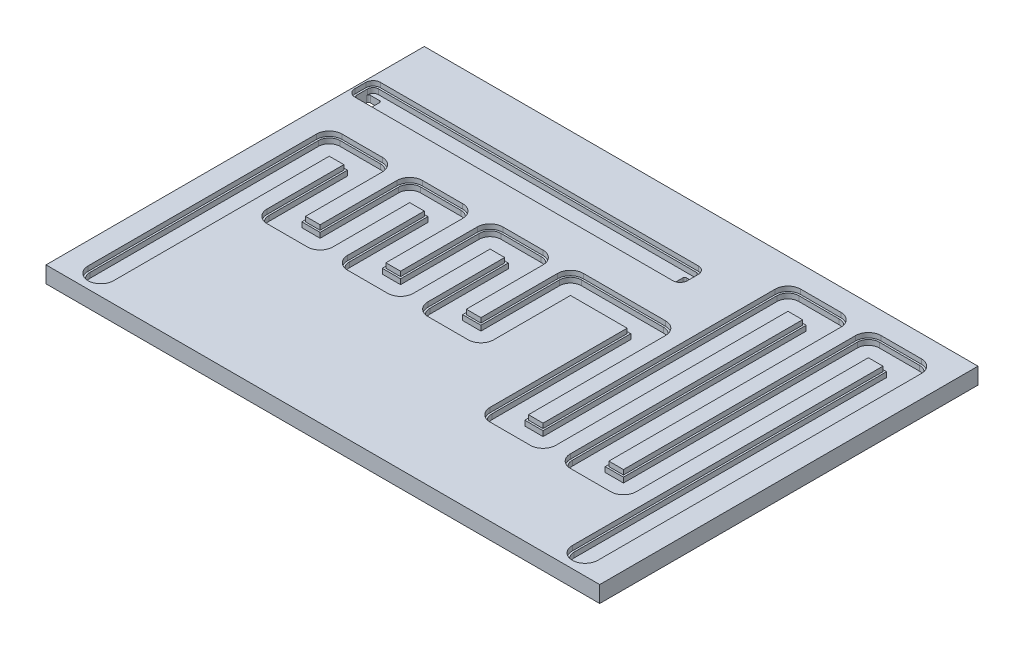
from build123d import *

# Parameters (mm, degrees)
SKETCH_1_W          = 1515
SKETCH_1_H          = 1035
EXTRUDE_1_DEPTH     = 45
CUT_EXTRUDE_1_DEPTH = 13
CUT_EXTRUDE_2_DEPTH = 27
CUT_EXTRUDE_3_DEPTH = 45
CUT_EXTRUDE_5_DEPTH = 13
CUT_EXTRUDE_6_DEPTH = 27
SKETCH_3_R          = 10.25
CUT_EXTRUDE_7_DEPTH = 45


with BuildPart() as part:
    # 草图1 → 凸台-拉伸1 (new body)
    with BuildSketch(Plane(origin=(0, 0, 0), x_dir=(1, 0, 0), z_dir=(0, 1, 0))):
        with Locations((757.5, -517.5)):
            Rectangle(SKETCH_1_W, SKETCH_1_H)
    extrude(amount=-EXTRUDE_1_DEPTH)

    # 草图1<3> → 切除-拉伸1 (cut)
    with BuildSketch(Plane(origin=(0, 0, 0), x_dir=(1, 0, 0), z_dir=(0, 1, 0))):
        with BuildLine():
            Line((5, -195), (5, -165))
            ThreePointArc((5, -165), (10.857864376, -150.857864376), (25, -145))
            Line((25, -145), (895, -145))
            ThreePointArc((895, -145), (909.142135624, -150.857864376), (915, -165))
            Line((915, -165), (915, -195))
            ThreePointArc((915, -195), (909.142135624, -209.142135624), (895, -215))
            Line((895, -215), (25, -215))
            ThreePointArc((25, -215), (10.857864376, -209.142135624), (5, -195))
        make_face()
    extrude(amount=-CUT_EXTRUDE_1_DEPTH, mode=Mode.SUBTRACT)

    # 草图1<5> → 切除-拉伸2 (cut)
    with BuildSketch(Plane(origin=(0, 0, 0), x_dir=(1, 0, 0), z_dir=(0, 1, 0))):
        with BuildLine():
            Line((25, -150), (895, -150))
            ThreePointArc((895, -150), (905.606601718, -154.393398282), (910, -165))
            Line((910, -165), (910, -195))
            ThreePointArc((910, -195), (905.606601718, -205.606601718), (895, -210))
            Line((895, -210), (25, -210))
            ThreePointArc((25, -210), (14.393398282, -205.606601718), (10, -195))
            Line((10, -195), (10, -165))
            ThreePointArc((10, -165), (14.393398282, -154.393398282), (25, -150))
        make_face()
    extrude(amount=-CUT_EXTRUDE_2_DEPTH, mode=Mode.SUBTRACT)

    # 草图1<6> → 切除-拉伸3 (cut)
    with BuildSketch(Plane(origin=(0, 0, 0), x_dir=(1, 0, 0), z_dir=(0, 1, 0))):
        with BuildLine():
            Line((40, -197.5), (15, -197.5))
            ThreePointArc((15, -197.5), (11.464466094, -196.035533906), (10, -192.5))
            Line((10, -192.5), (10, -167.5))
            ThreePointArc((10, -167.5), (11.464466094, -163.964466094), (15, -162.5))
            Line((15, -162.5), (40, -162.5))
            ThreePointArc((40, -162.5), (43.535533906, -163.964466094), (45, -167.5))
            Line((45, -167.5), (45, -192.5))
            ThreePointArc((45, -192.5), (43.535533906, -196.035533906), (40, -197.5))
        make_face()
        with BuildLine():
            Line((905, -197.5), (880, -197.5))
            ThreePointArc((880, -197.5), (876.464466094, -196.035533906), (875, -192.5))
            Line((875, -192.5), (875, -167.5))
            ThreePointArc((875, -167.5), (876.464466094, -163.964466094), (880, -162.5))
            Line((880, -162.5), (905, -162.5))
            ThreePointArc((905, -162.5), (908.535533906, -163.964466094), (910, -167.5))
            Line((910, -167.5), (910, -192.5))
            ThreePointArc((910, -192.5), (908.535533906, -196.035533906), (905, -197.5))
        make_face()
    extrude(amount=-CUT_EXTRUDE_3_DEPTH, mode=Mode.SUBTRACT)

    # 草图1<9> → 切除-拉伸5 (cut)
    with BuildSketch(Plane(origin=(0, 0, 0), x_dir=(1, 0, 0), z_dir=(0, 1, 0))):
        with BuildLine():
            Line((60, -980), (60, -355))
            ThreePointArc((60, -355), (70.251262658, -330.251262658), (95, -320))
            Line((95, -320), (205, -320))
            ThreePointArc((205, -320), (229.748737342, -330.251262658), (240, -355))
            Line((240, -355), (240, -565))
            Line((240, -565), (280, -565))
            Line((280, -565), (280, -355))
            ThreePointArc((280, -355), (290.251262658, -330.251262658), (315, -320))
            Line((315, -320), (425, -320))
            ThreePointArc((425, -320), (449.748737342, -330.251262658), (460, -355))
            Line((460, -355), (460, -565))
            Line((460, -565), (500, -565))
            Line((500, -565), (500, -355))
            ThreePointArc((500, -355), (510.251262658, -330.251262658), (535, -320))
            Line((535, -320), (645, -320))
            ThreePointArc((645, -320), (669.748737342, -330.251262658), (680, -355))
            Line((680, -355), (680, -565))
            Line((680, -565), (720, -565))
            Line((720, -565), (720, -355))
            ThreePointArc((720, -355), (730.251262658, -330.251262658), (755, -320))
            Line((755, -320), (980, -320))
            ThreePointArc((980, -320), (1004.748737342, -330.251262658), (1015, -355))
            Line((1015, -355), (1015, -730))
            Line((1015, -730), (1055, -730))
            Line((1055, -730), (1055, -95))
            ThreePointArc((1055, -95), (1065.251262658, -70.251262658), (1090, -60))
            Line((1090, -60), (1200, -60))
            ThreePointArc((1200, -60), (1224.748737342, -70.251262658), (1235, -95))
            Line((1235, -95), (1235, -730))
            Line((1235, -730), (1275, -730))
            Line((1275, -730), (1275, -95))
            ThreePointArc((1275, -95), (1285.251262658, -70.251262658), (1310, -60))
            Line((1310, -60), (1420, -60))
            ThreePointArc((1420, -60), (1444.748737342, -70.251262658), (1455, -95))
            Line((1455, -95), (1455, -980))
            ThreePointArc((1455, -980), (1420, -1015), (1385, -980))
            Line((1385, -980), (1385, -130))
            Line((1385, -130), (1345, -130))
            Line((1345, -130), (1345, -765))
            ThreePointArc((1345, -765), (1334.748737342, -789.748737342), (1310, -800))
            Line((1310, -800), (1200, -800))
            ThreePointArc((1200, -800), (1175.251262658, -789.748737342), (1165, -765))
            Line((1165, -765), (1165, -130))
            Line((1165, -130), (1125, -130))
            Line((1125, -130), (1125, -765))
            ThreePointArc((1125, -765), (1114.748737342, -789.748737342), (1090, -800))
            Line((1090, -800), (980, -800))
            ThreePointArc((980, -800), (955.251262658, -789.748737342), (945, -765))
            Line((945, -765), (945, -390))
            Line((945, -390), (790, -390))
            Line((790, -390), (790, -600))
            ThreePointArc((790, -600), (779.748737342, -624.748737342), (755, -635))
            Line((755, -635), (645, -635))
            ThreePointArc((645, -635), (620.251262658, -624.748737342), (610, -600))
            Line((610, -600), (610, -390))
            Line((610, -390), (570, -390))
            Line((570, -390), (570, -600))
            ThreePointArc((570, -600), (559.748737342, -624.748737342), (535, -635))
            Line((535, -635), (425, -635))
            ThreePointArc((425, -635), (400.251262658, -624.748737342), (390, -600))
            Line((390, -600), (390, -390))
            Line((390, -390), (350, -390))
            Line((350, -390), (350, -600))
            ThreePointArc((350, -600), (339.748737342, -624.748737342), (315, -635))
            Line((315, -635), (205, -635))
            ThreePointArc((205, -635), (180.251262658, -624.748737342), (170, -600))
            Line((170, -600), (170, -390))
            Line((170, -390), (130, -390))
            Line((130, -390), (130, -980))
            ThreePointArc((130, -980), (95, -1015), (60, -980))
        make_face()
    extrude(amount=-CUT_EXTRUDE_5_DEPTH, mode=Mode.SUBTRACT)

    # 草图1<10> → 切除-拉伸6 (cut)
    with BuildSketch(Plane(origin=(0, 0, 0), x_dir=(1, 0, 0), z_dir=(0, 1, 0))):
        with BuildLine():
            Line((1390, -980), (1390, -125))
            Line((1390, -125), (1340, -125))
            Line((1340, -125), (1340, -765))
            ThreePointArc((1340, -765), (1331.213203436, -786.213203436), (1310, -795))
            Line((1310, -795), (1200, -795))
            ThreePointArc((1200, -795), (1178.786796564, -786.213203436), (1170, -765))
            Line((1170, -765), (1170, -125))
            Line((1170, -125), (1120, -125))
            Line((1120, -125), (1120, -765))
            ThreePointArc((1120, -765), (1111.213203436, -786.213203436), (1090, -795))
            Line((1090, -795), (980, -795))
            ThreePointArc((980, -795), (958.786796564, -786.213203436), (950, -765))
            Line((950, -765), (950, -385))
            Line((950, -385), (785, -385))
            Line((785, -385), (785, -600))
            ThreePointArc((785, -600), (776.213203436, -621.213203436), (755, -630))
            Line((755, -630), (645, -630))
            ThreePointArc((645, -630), (623.786796564, -621.213203436), (615, -600))
            Line((615, -600), (615, -385))
            Line((615, -385), (565, -385))
            Line((565, -385), (565, -600))
            ThreePointArc((565, -600), (556.213203436, -621.213203436), (535, -630))
            Line((535, -630), (425, -630))
            ThreePointArc((425, -630), (403.786796564, -621.213203436), (395, -600))
            Line((395, -600), (395, -385))
            Line((395, -385), (345, -385))
            Line((345, -385), (345, -600))
            ThreePointArc((345, -600), (336.213203436, -621.213203436), (315, -630))
            Line((315, -630), (205, -630))
            ThreePointArc((205, -630), (183.786796564, -621.213203436), (175, -600))
            Line((175, -600), (175, -385))
            Line((175, -385), (125, -385))
            Line((125, -385), (125, -980))
            ThreePointArc((125, -980), (95, -1010), (65, -980))
            Line((65, -980), (65, -355))
            ThreePointArc((65, -355), (73.786796564, -333.786796564), (95, -325))
            Line((95, -325), (205, -325))
            ThreePointArc((205, -325), (226.213203436, -333.786796564), (235, -355))
            Line((235, -355), (235, -570))
            Line((235, -570), (285, -570))
            Line((285, -570), (285, -355))
            ThreePointArc((285, -355), (293.786796564, -333.786796564), (315, -325))
            Line((315, -325), (425, -325))
            ThreePointArc((425, -325), (446.213203436, -333.786796564), (455, -355))
            Line((455, -355), (455, -570))
            Line((455, -570), (505, -570))
            Line((505, -570), (505, -355))
            ThreePointArc((505, -355), (513.786796564, -333.786796564), (535, -325))
            Line((535, -325), (645, -325))
            ThreePointArc((645, -325), (666.213203436, -333.786796564), (675, -355))
            Line((675, -355), (675, -570))
            Line((675, -570), (725, -570))
            Line((725, -570), (725, -355))
            ThreePointArc((725, -355), (733.786796564, -333.786796564), (755, -325))
            Line((755, -325), (980, -325))
            ThreePointArc((980, -325), (1001.213203436, -333.786796564), (1010, -355))
            Line((1010, -355), (1010, -735))
            Line((1010, -735), (1060, -735))
            Line((1060, -735), (1060, -95))
            ThreePointArc((1060, -95), (1068.786796564, -73.786796564), (1090, -65))
            Line((1090, -65), (1200, -65))
            ThreePointArc((1200, -65), (1221.213203436, -73.786796564), (1230, -95))
            Line((1230, -95), (1230, -735))
            Line((1230, -735), (1280, -735))
            Line((1280, -735), (1280, -95))
            ThreePointArc((1280, -95), (1288.786796564, -73.786796564), (1310, -65))
            Line((1310, -65), (1420, -65))
            ThreePointArc((1420, -65), (1441.213203436, -73.786796564), (1450, -95))
            Line((1450, -95), (1450, -980))
            ThreePointArc((1450, -980), (1420, -1010), (1390, -980))
        make_face()
    extrude(amount=-CUT_EXTRUDE_6_DEPTH, mode=Mode.SUBTRACT)

    # 草图3 → 切除-拉伸7 (cut)
    with BuildSketch(Plane(origin=(0, 0, 0), x_dir=(1, 0, 0), z_dir=(0, 1, 0))):
        with Locations((95, -990)):
            Circle(SKETCH_3_R)
        with Locations((1420, -990)):
            Circle(SKETCH_3_R)
    extrude(amount=-CUT_EXTRUDE_7_DEPTH, mode=Mode.SUBTRACT)


solid = part.part
